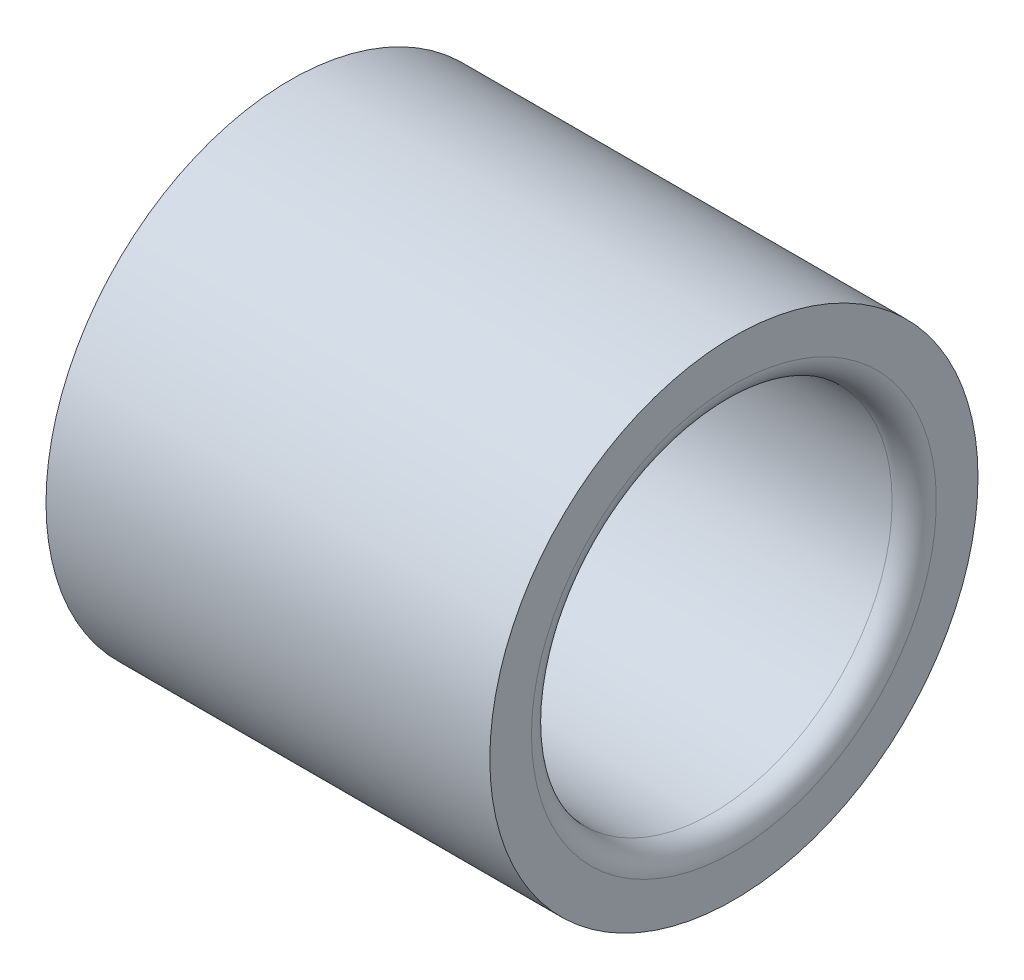
from build123d import *

# Parameters (mm, degrees)
DRAFT1_ANGLE = 0.5
FILLET2_R    = 1


with BuildPart() as part:
    # Sketch1 → Revolve1 (revolve)
    with BuildSketch(Plane.XY, mode=Mode.PRIVATE) as revolve1_sk:
        Polygon((0, 0), (5, 0), (5, 4), (20, 4), (20, 7), (0, 7), align=None)
    revolve(revolve1_sk.sketch.rotate(Axis((-15.220779221, -4, 0), (1, 0, 0)), 90), axis=Axis((-15.220779221, -4, 0), (1, 0, 0)))

    # Draft1
    draft1_faces = [part.faces().sort_by_distance(p)[0] for p in [
        (12.5, -4, -8),
    ]]
    draft(draft1_faces, Plane(origin=(5, 0, 0), x_dir=(0, 0, 1), z_dir=(1, 0, 0)), DRAFT1_ANGLE)

    # Fillet2
    fillet2_edges = [part.edges().sort_by_distance(p)[0] for p in [
        (20, -4, -8.130903017),
    ]]
    fillet(fillet2_edges, radius=FILLET2_R)


solid = part.part
